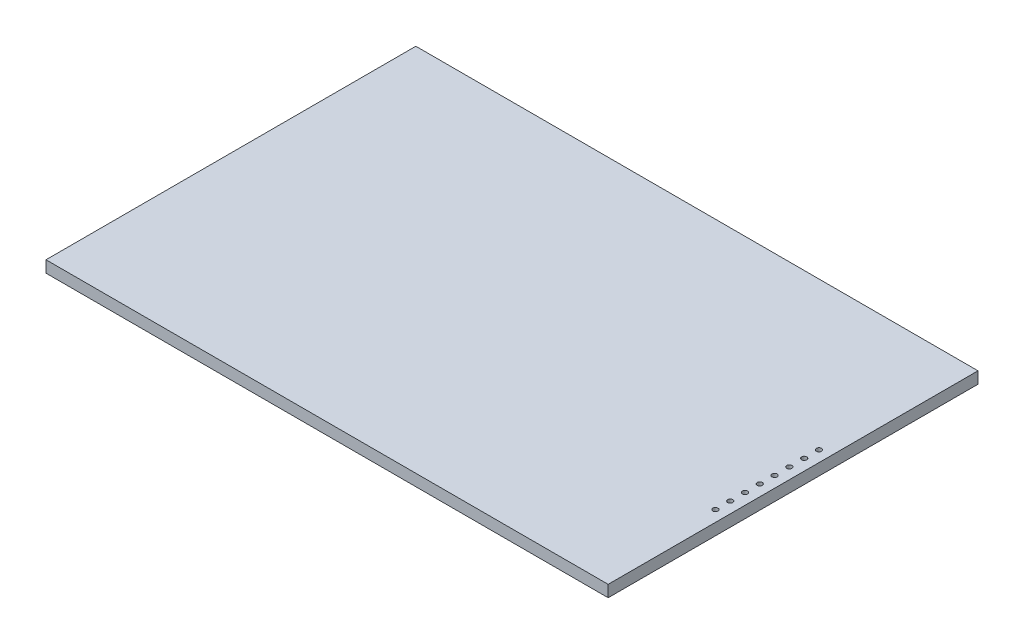
from build123d import *

# Parameters (mm, degrees)
SKETCH1_W           = 96.52
SKETCH1_H           = 63.5
BOSS_EXTRUDE1_DEPTH = 2
SKETCH2_R           = 0.4445
CUT_EXTRUDE1_DEPTH  = 116.552414081


with BuildPart() as part:
    # Sketch1 → Boss-Extrude1 (new body)
    with BuildSketch(Plane(origin=(0, 0, 0), x_dir=(1, 0, 0), z_dir=(0, 1, 0))):
        with Locations((-48.26, 31.75)):
            Rectangle(SKETCH1_W, SKETCH1_H)
    extrude(amount=BOSS_EXTRUDE1_DEPTH)

    # Sketch2 → Cut-Extrude1 (cut, through all)
    with BuildSketch(Plane(origin=(0, 2, 0), x_dir=(1, 0, 0), z_dir=(0, 1, 0))):
        with Locations(Location((-1.905, 38.1, 0), (0, 0, 270))):
            Circle(SKETCH2_R)
        with Locations(Location((-1.905, 35.56, 0), (0, 0, 270))):
            Circle(SKETCH2_R)
        with Locations(Location((-1.905, 33.02, 0), (0, 0, 270))):
            Circle(SKETCH2_R)
        with Locations(Location((-1.905, 30.48, 0), (0, 0, 270))):
            Circle(SKETCH2_R)
        with Locations(Location((-1.905, 27.94, 0), (0, 0, 270))):
            Circle(SKETCH2_R)
        with Locations(Location((-1.905, 25.4, 0), (0, 0, 270))):
            Circle(SKETCH2_R)
        with Locations(Location((-1.905, 22.86, 0), (0, 0, 270))):
            Circle(SKETCH2_R)
        with Locations(Location((-1.905, 20.32, 0), (0, 0, 270))):
            Circle(SKETCH2_R)
    extrude(amount=-CUT_EXTRUDE1_DEPTH, mode=Mode.SUBTRACT)


solid = part.part
